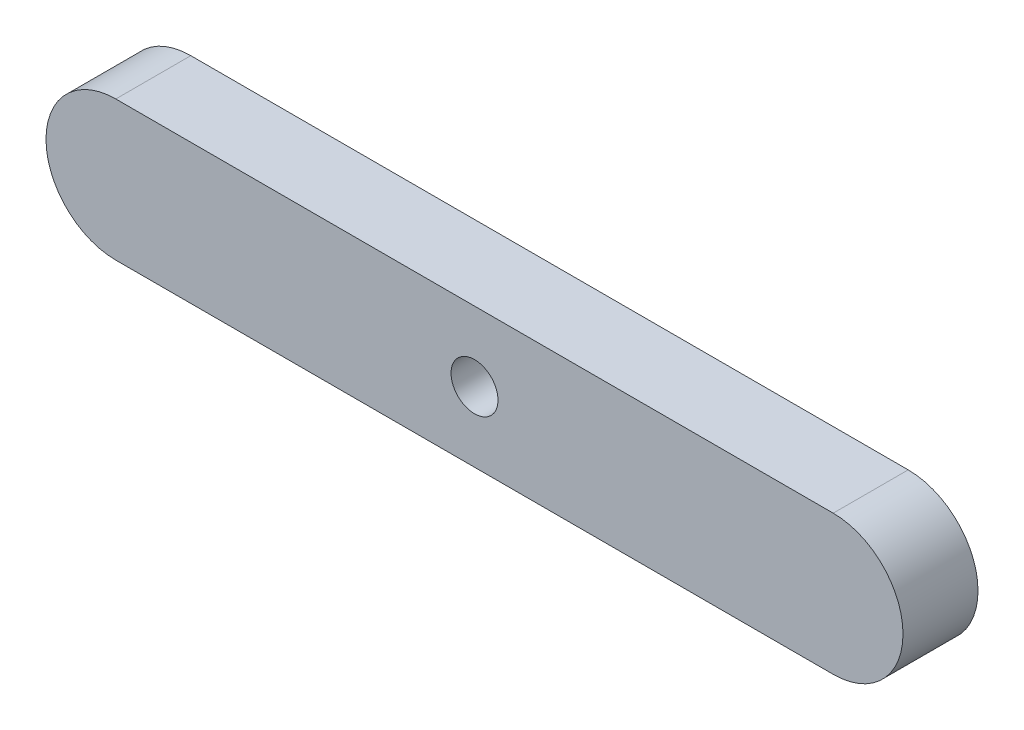
from build123d import *

# Parameters (mm, degrees)
BOSS_EXTRUDE1_DEPTH = 10
SKETCH2_R           = 3.129697436
CUT_EXTRUDE1_DEPTH  = 24


with BuildPart() as part:
    # Sketch1 → Boss-Extrude1 (new body)
    with BuildSketch(Plane.XY):
        with BuildLine():
            Line((41.116857141, -9.305393984), (-54.533936839, -9.305393984))
            ThreePointArc((-54.533936839, -9.305393984), (-63.839330824, 0), (-54.533936839, 9.305393984))
            Line((-54.533936839, 9.305393984), (41.116857141, 9.305393984))
            ThreePointArc((41.116857141, 9.305393984), (50.422251125, 0), (41.116857141, -9.305393984))
        make_face()
    extrude(amount=BOSS_EXTRUDE1_DEPTH)

    # Sketch2 → Cut-Extrude1 (cut)
    with BuildSketch(Plane.XY.offset(10)):
        with Locations((-6.708539849, 0)):
            Circle(SKETCH2_R)
    extrude(amount=-CUT_EXTRUDE1_DEPTH, mode=Mode.SUBTRACT)


solid = part.part
